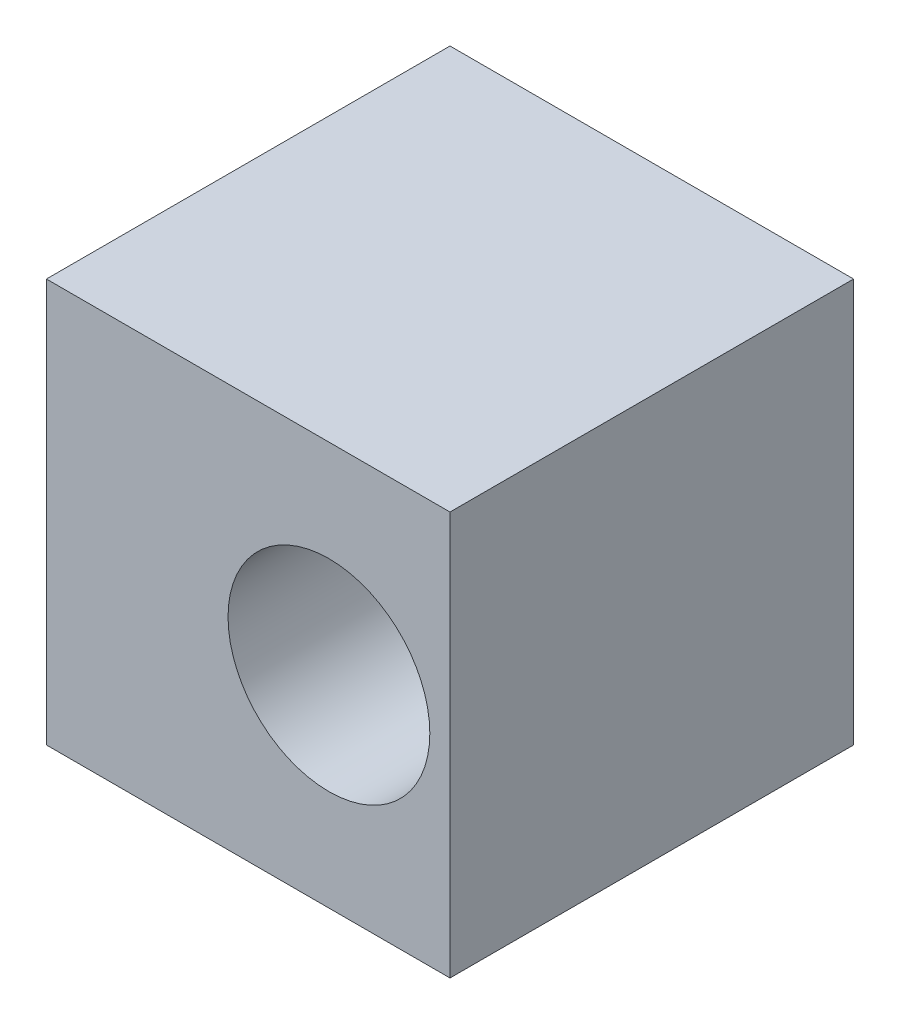
from build123d import *

# Parameters (mm, degrees)
SKETCH1_W           = 10
SKETCH1_H           = 10
BOSS_EXTRUDE1_DEPTH = 10
SKETCH2_R           = 2.5
CUT_EXTRUDE1_DEPTH  = 18.320508076


with BuildPart() as part:
    # Sketch1 → Boss-Extrude1 (new body)
    with BuildSketch(Plane.XY):
        with Locations((5, 5)):
            Rectangle(SKETCH1_W, SKETCH1_H)
    extrude(amount=BOSS_EXTRUDE1_DEPTH)

    # Sketch2 → Cut-Extrude1 (cut, through all)
    with BuildSketch(Plane.XY):
        with Locations((7, 5)):
            Circle(SKETCH2_R)
    extrude(amount=CUT_EXTRUDE1_DEPTH, mode=Mode.SUBTRACT)


solid = part.part
